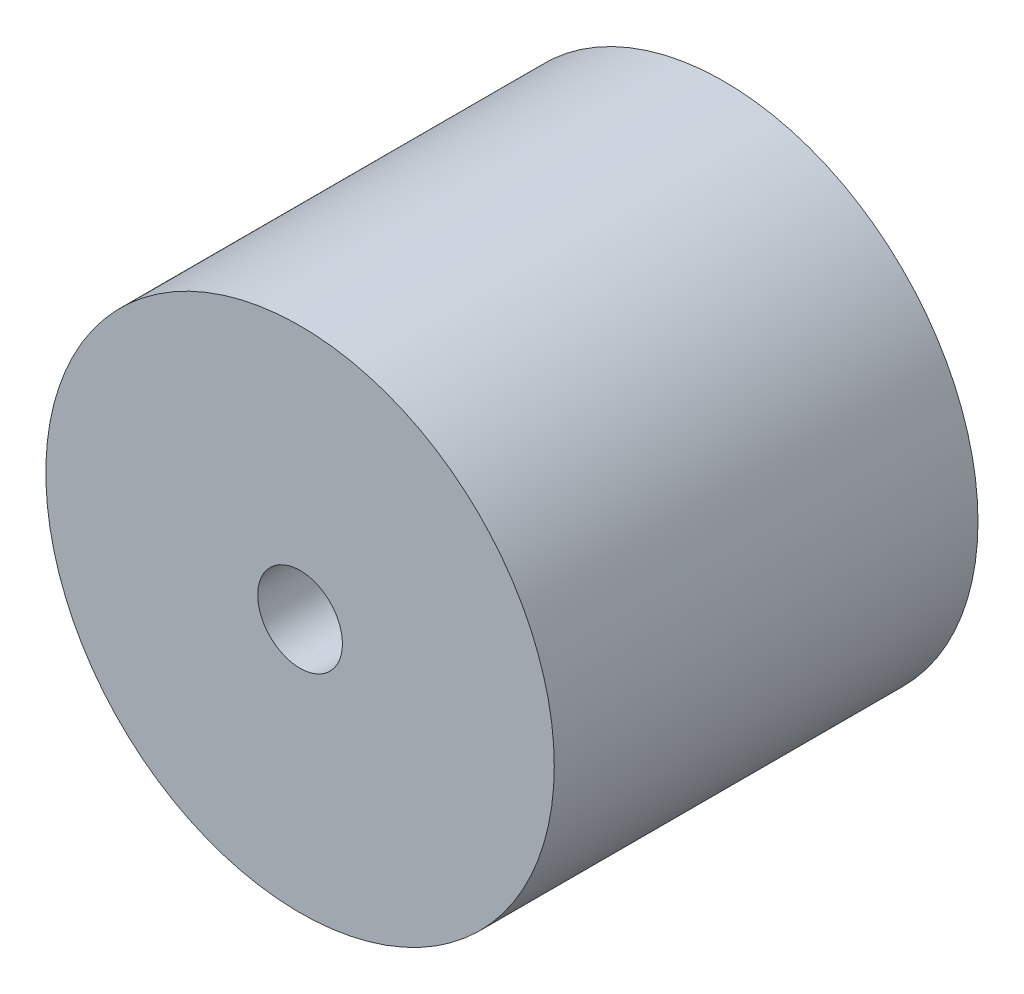
from build123d import *

# Parameters (mm, degrees)
SKETCH1_R           = 18
SKETCH1_R_2         = 3
BOSS_EXTRUDE1_DEPTH = 15


with BuildPart() as part:
    # Sketch1 → Boss-Extrude1 (new, symmetric)
    with BuildSketch(Plane.XY):
        Circle(SKETCH1_R)
        Circle(SKETCH1_R_2, mode=Mode.SUBTRACT)
    extrude(amount=BOSS_EXTRUDE1_DEPTH, both=True)


solid = part.part
